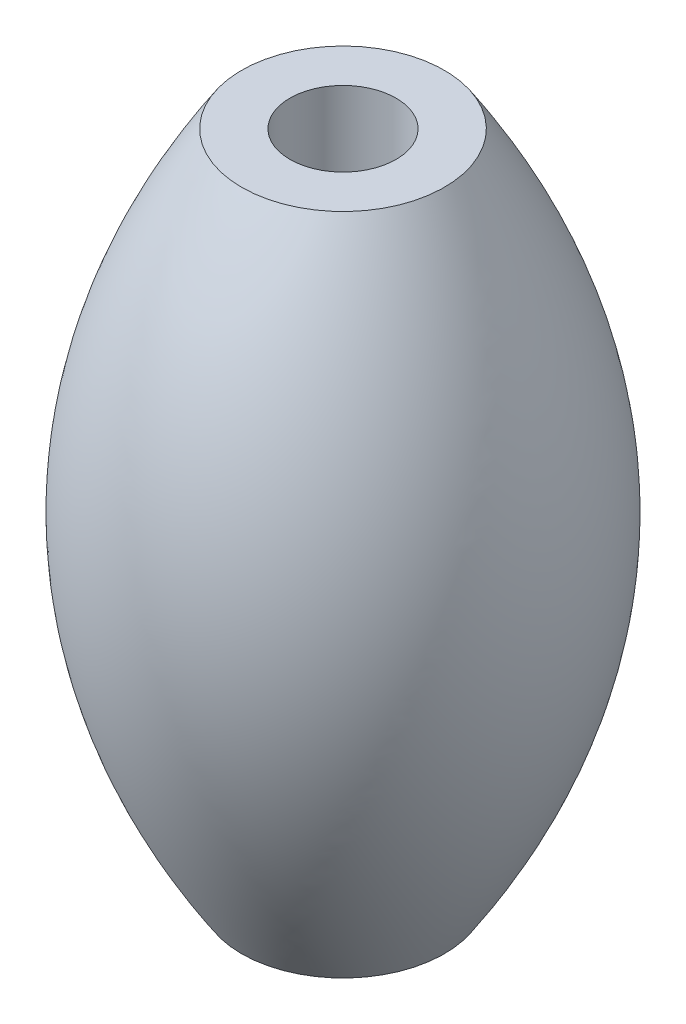
from build123d import *


with BuildPart() as part:
    # Sketch1 → Revolve1 (revolve)
    with BuildSketch(Plane.XY, mode=Mode.PRIVATE) as revolve1_sk:
        with BuildLine():
            Line((2.2, 0), (2.2, 13.75))
            Line((2.2, 13.75), (4.2, 13.75))
            add(Edge.make_bspline(
                [(4.2, 13.75), (13.2, 0), (4.2, -13.75)],
                knots=[0, 0, 0, 1, 1, 1], degree=2))
            Line((4.2, -13.75), (2.2, -13.75))
            Line((2.2, -13.75), (2.2, 0))
        make_face()
    revolve(revolve1_sk.sketch.rotate(Axis((0, 36.000042735, 0), (0, -1, 0)), 90), axis=Axis((0, 36.000042735, 0), (0, -1, 0)))


solid = part.part
